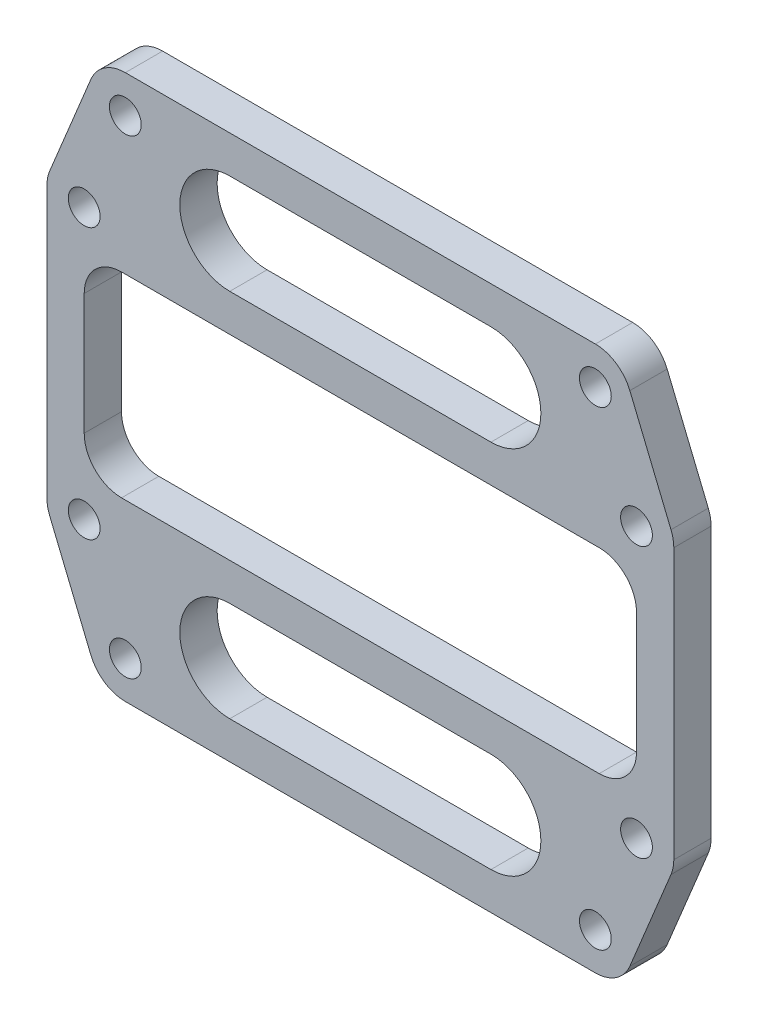
from build123d import *

# Parameters (mm, degrees)
SKETCH1_R             = 3.175
BOSS_EXTRUDE1_DEPTH   = 3.175
FILLET1_R             = 3.175
F_2_CLEARANCE_HOLE1_D = 2.7051
F_2_CLEARANCE_HOLE2_D = 2.7051
CUT_EXTRUDE1_DEPTH    = 131.094336971


with BuildPart() as part:
    # Sketch1 → Boss-Extrude1 (new body)
    with BuildSketch(Plane.XY):
        with BuildLine():
            ThreePointArc((-89.910569383, 80.265306107), (-93.701723521, 77.150666629), (-96.021422346, 81.474186739))
            Line((-96.021422346, 81.474186739), (-99.521422346, 72.974186739))
            ThreePointArc((-99.521422346, 72.974186739), (-95.969415245, 74.879945585), (-93.410569383, 71.765306107))
            ThreePointArc((-93.410569383, 71.765306107), (-94.340505353, 69.520242077), (-96.585569383, 68.590306107))
            Line((-96.585569383, 68.590306107), (-49.585569383, 68.590306107))
            ThreePointArc((-49.585569383, 68.590306107), (-52.223638848, 73.532002034), (-46.649716421, 72.974186739))
            Line((-46.649716421, 72.974186739), (-50.149716421, 81.474186739))
            ThreePointArc((-50.149716421, 81.474186739), (-49.970929905, 80.881460245), (-49.910569383, 80.265306107))
            ThreePointArc((-49.910569383, 80.265306107), (-55.330633414, 78.020242077), (-53.085569383, 83.440306107))
            Line((-53.085569383, 83.440306107), (-93.085569383, 83.440306107))
            ThreePointArc((-93.085569383, 83.440306107), (-90.840505353, 82.510370138), (-89.910569383, 80.265306107))
        make_face()
        with Locations((-93.085569383, 80.265306107)):
            Circle(SKETCH1_R)
        with Locations((-96.585569383, 71.765306107)):
            Circle(SKETCH1_R)
        with Locations((-49.585569383, 71.765306107)):
            Circle(SKETCH1_R)
        with Locations((-53.085569383, 80.265306107)):
            Circle(SKETCH1_R)
        with BuildLine():
            ThreePointArc((-46.410569383, 71.765306107), (-47.340505353, 69.520242077), (-49.585569383, 68.590306107))
            Line((-49.585569383, 68.590306107), (-49.585569383, 51.940306107))
            ThreePointArc((-49.585569383, 51.940306107), (-47.340505353, 51.010370138), (-46.410569383, 48.765306107))
            Line((-46.410569383, 48.765306107), (-46.410569383, 71.765306107))
        make_face()
        with Locations((-49.585569383, 48.765306107)):
            Circle(SKETCH1_R)
        with Locations((-53.085569383, 40.265306107)):
            Circle(SKETCH1_R)
        with BuildLine():
            Line((-49.585569383, 51.940306107), (-96.585569383, 51.940306107))
            ThreePointArc((-96.585569383, 51.940306107), (-94.340505353, 51.010370138), (-93.410569383, 48.765306107))
            ThreePointArc((-93.410569383, 48.765306107), (-95.969415245, 45.650666629), (-99.521422346, 47.556425476))
            Line((-99.521422346, 47.556425476), (-96.021422346, 39.056425476))
            ThreePointArc((-96.021422346, 39.056425476), (-93.701723521, 43.379945585), (-89.910569383, 40.265306107))
            ThreePointArc((-89.910569383, 40.265306107), (-90.840505353, 38.020242077), (-93.085569383, 37.090306107))
            Line((-93.085569383, 37.090306107), (-53.085569383, 37.090306107))
            ThreePointArc((-53.085569383, 37.090306107), (-55.330633414, 42.510370138), (-49.910569383, 40.265306107))
            ThreePointArc((-49.910569383, 40.265306107), (-49.970929905, 39.649151969), (-50.149716421, 39.056425476))
            Line((-50.149716421, 39.056425476), (-46.649716421, 47.556425476))
            ThreePointArc((-46.649716421, 47.556425476), (-52.223638848, 46.998610181), (-49.585569383, 51.940306107))
        make_face()
        with Locations((-93.085569383, 40.265306107)):
            Circle(SKETCH1_R)
        with Locations((-96.585569383, 48.765306107)):
            Circle(SKETCH1_R)
        with BuildLine():
            ThreePointArc((-96.585569383, 68.590306107), (-98.830633414, 69.520242077), (-99.760569383, 71.765306107))
            Line((-99.760569383, 71.765306107), (-99.760569383, 48.765306107))
            ThreePointArc((-99.760569383, 48.765306107), (-98.830633414, 51.010370138), (-96.585569383, 51.940306107))
            Line((-96.585569383, 51.940306107), (-96.585569383, 68.590306107))
        make_face()
    extrude(amount=BOSS_EXTRUDE1_DEPTH)

    # Fillet1
    fillet1_edges = [part.edges().sort_by_distance(p)[0] for p in [
        (-96.585569383, 68.590306107, 1.5875),
        (-96.585569383, 51.940306107, 1.5875),
        (-49.585569383, 51.940306107, 1.5875),
        (-49.585569383, 68.590306107, 1.5875),
    ]]
    fillet(fillet1_edges, radius=FILLET1_R)

    # #2 Clearance Hole1 (through all)
    with Locations(Plane.XY.offset(3.175)):
        with Locations((-93.085569383, 80.265306107), (-53.085569383, 80.265306107), (-53.085569383, 40.265306107), (-93.085569383, 40.265306107)):
            Hole(F_2_CLEARANCE_HOLE1_D / 2)

    # #2 Clearance Hole2 (through all)
    with Locations(Plane.XY.offset(3.175)):
        with Locations((-96.585569383, 71.765306107), (-49.585569383, 71.765306107), (-49.585569383, 48.765306107), (-96.585569383, 48.765306107)):
            Hole(F_2_CLEARANCE_HOLE2_D / 2)

    # Sketch6 → Cut-Extrude1 (cut, through all)
    with BuildSketch(Plane.XY.offset(3.175)):
        with BuildLine():
            Line((-84.198069383, 80.265306107), (-61.973069383, 80.265306107))
            ThreePointArc((-61.973069383, 80.265306107), (-57.723069383, 76.015306107), (-61.973069383, 71.765306107))
            Line((-61.973069383, 71.765306107), (-84.198069383, 71.765306107))
            ThreePointArc((-84.198069383, 71.765306107), (-88.448069383, 76.015306107), (-84.198069383, 80.265306107))
        make_face()
        with BuildLine():
            Line((-84.198069383, 40.265306107), (-61.973069383, 40.265306107))
            ThreePointArc((-61.973069383, 40.265306107), (-57.723069383, 44.515306107), (-61.973069383, 48.765306107))
            Line((-61.973069383, 48.765306107), (-84.198069383, 48.765306107))
            ThreePointArc((-84.198069383, 48.765306107), (-88.448069383, 44.515306107), (-84.198069383, 40.265306107))
        make_face()
    extrude(amount=-CUT_EXTRUDE1_DEPTH, mode=Mode.SUBTRACT)


solid = part.part
